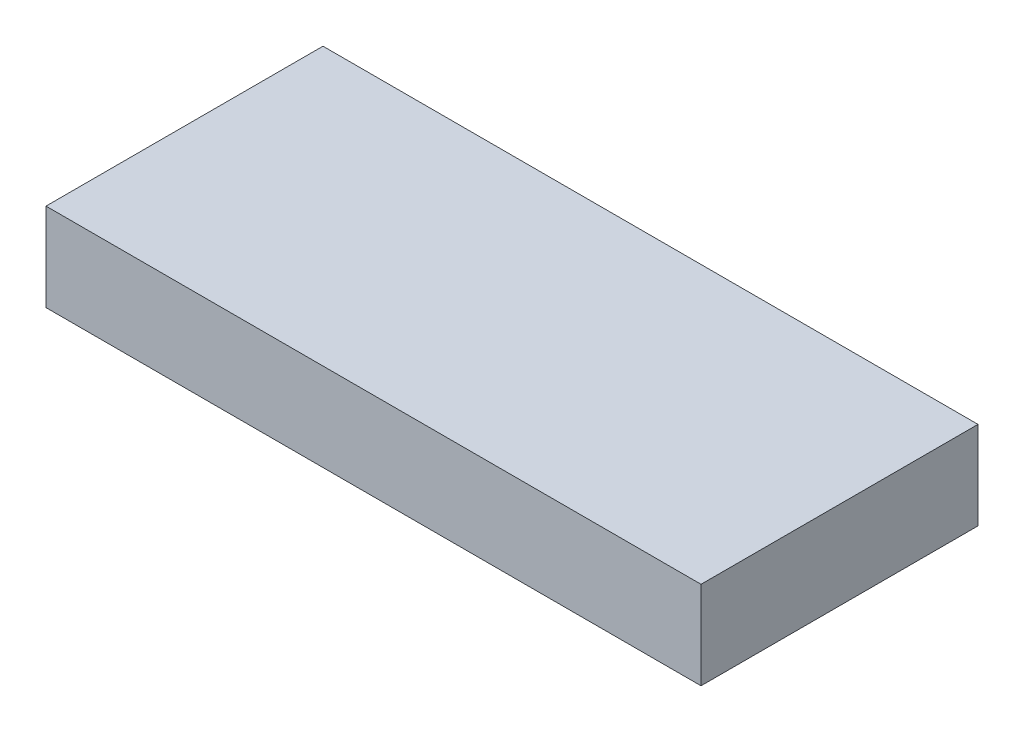
from build123d import *

# Parameters (mm, degrees)
SKETCH1_W           = 47.3
SKETCH1_H           = 20
BOSS_EXTRUDE1_DEPTH = 6.35


with BuildPart() as part:
    # Sketch1 → Boss-Extrude1 (new body)
    with BuildSketch(Plane(origin=(0, 0, 0), x_dir=(1, 0, 0), z_dir=(0, 1, 0))):
        with Locations((23.65, 10)):
            Rectangle(SKETCH1_W, SKETCH1_H)
    extrude(amount=BOSS_EXTRUDE1_DEPTH)


solid = part.part
